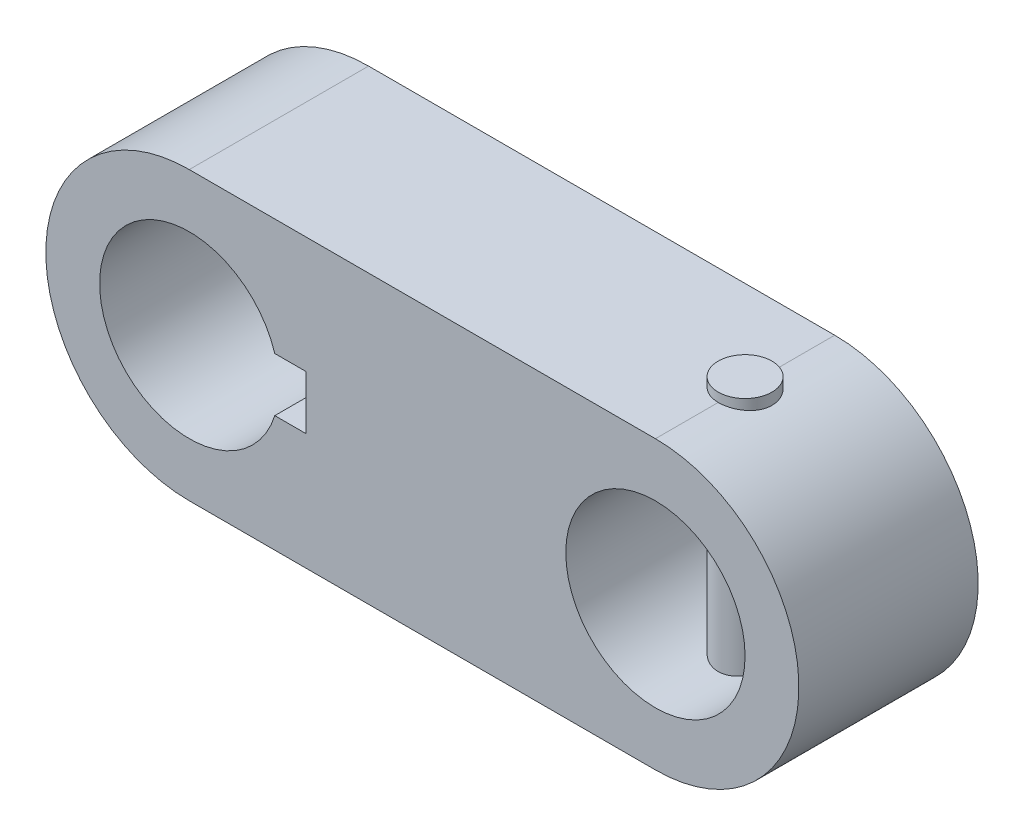
from build123d import *

# Parameters (mm, degrees)
SKETCH1_R               = 5
BOSS_EXTRUDE1_DEPTH     = 5
CUT_EXTRUDE1_DEPTH      = 24.021728866
CUT_EXTRUDE1_DEPTH_BACK = 24.021728866
SKETCH2_R               = 1.5
SKETCH2_2_R             = 1.5
BOSS_EXTRUDE2_DEPTH     = 8.5


with BuildPart() as part:
    # Sketch1 → Boss-Extrude1 (new, symmetric)
    with BuildSketch(Plane.XY):
        with BuildLine():
            Line((13, 8), (-13, 8))
            ThreePointArc((-13, 8), (-21, 0), (-13, -8))
            Line((-13, -8), (13, -8))
            ThreePointArc((13, -8), (21, 0), (13, 8))
        make_face()
        with Locations((13, 0)):
            Circle(SKETCH1_R, mode=Mode.SUBTRACT)
        with BuildLine():
            Line((-8.230303993, 1.5), (-6.5, 1.5))
            Line((-6.5, 1.5), (-6.5, -1.5))
            Line((-6.5, -1.5), (-8.230303993, -1.5))
            ThreePointArc((-8.230303993, -1.5), (-18, 0), (-8.230303993, 1.5))
        make_face(mode=Mode.SUBTRACT)
    extrude(amount=BOSS_EXTRUDE1_DEPTH, both=True)

    # Sketch2 → Cut-Extrude1 (cut, two sides: drawn at the far end of the back side and taken through both)
    with BuildSketch(Plane(origin=(0, 0, 0), x_dir=(1, 0, 0), z_dir=(0, 1, 0)).offset(-CUT_EXTRUDE1_DEPTH_BACK)):
        with Locations((13, 0)):
            Circle(SKETCH2_R)
    extrude(amount=CUT_EXTRUDE1_DEPTH + CUT_EXTRUDE1_DEPTH_BACK, mode=Mode.SUBTRACT)


with BuildPart() as body_2:
    # Sketch2<2> → Boss-Extrude2 (new, symmetric)
    with BuildSketch(Plane(origin=(0, 0, 0), x_dir=(1, 0, 0), z_dir=(0, 1, 0))):
        with Locations((13, 0)):
            Circle(SKETCH2_2_R)
    extrude(amount=BOSS_EXTRUDE2_DEPTH, both=True)


solid = Compound([part.part, body_2.part])
